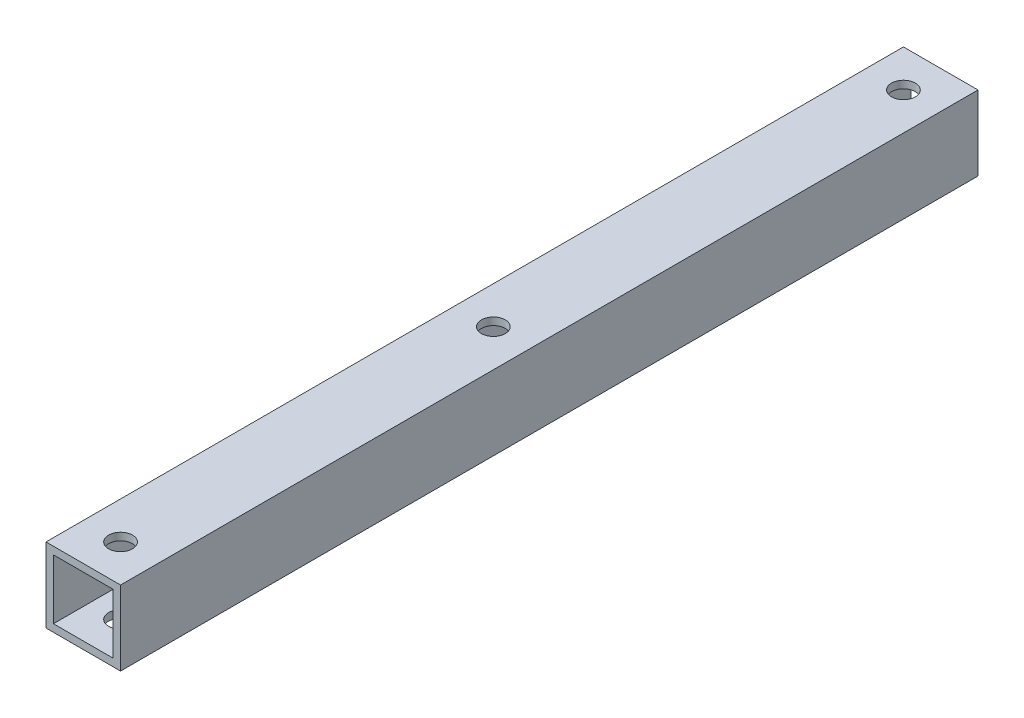
from build123d import *

# Parameters (mm, degrees)
SKETCH_282_W          = 10
SKETCH_282_H          = 10
SKETCH_282_W_2        = 8
SKETCH_282_H_2        = 8
EXTRUDE_339_DEPTH     = 115
SKETCH_411_R          = 1.6
CUT_EXTRUDE_788_DEPTH = 116.542200083


with BuildPart() as part:
    # Sketch 282 → Extrude 339 (new body)
    with BuildSketch(Plane.XY):
        Rectangle(SKETCH_282_W, SKETCH_282_H)
        Rectangle(SKETCH_282_W_2, SKETCH_282_H_2, mode=Mode.SUBTRACT)
    extrude(amount=EXTRUDE_339_DEPTH)

    # Sketch 411 → Cut-Extrude 788 (cut, through all)
    with BuildSketch(Plane(origin=(0, 5, 0), x_dir=(1, 0, 0), z_dir=(0, 1, 0))):
        with Locations(Location((0, -5, 0), (0, 0, 270))):
            Circle(SKETCH_411_R)
        with Locations(Location((0, -60, 0), (0, 0, 270))):
            Circle(SKETCH_411_R)
        with Locations(Location((0, -110, 0), (0, 0, 270))):
            Circle(SKETCH_411_R)
    extrude(amount=-CUT_EXTRUDE_788_DEPTH, mode=Mode.SUBTRACT)


solid = part.part
